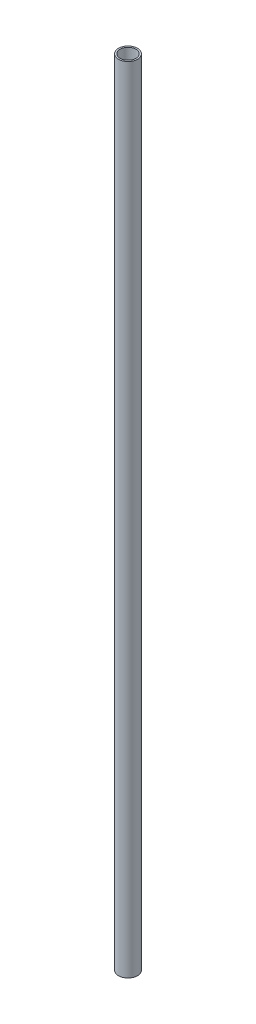
from build123d import *

# Parameters (mm, degrees)
BOSS_EXTRUDE1_DEPTH      = 250
BOSS_EXTRUDE1_DEPTH_BACK = 250
SKETCH1_R                = 6
SKETCH1_R_2              = 5


with BuildPart() as part:
    # Sketch1 → Boss-Extrude1 (new, two sides: drawn at the far end of the back side and taken through both)
    with BuildSketch(Plane(origin=(0, 0, 0), x_dir=(1, 0, 0), z_dir=(0, 1, 0)).offset(-BOSS_EXTRUDE1_DEPTH_BACK)):
        Circle(SKETCH1_R)
        Circle(SKETCH1_R_2, mode=Mode.SUBTRACT)
    extrude(amount=BOSS_EXTRUDE1_DEPTH + BOSS_EXTRUDE1_DEPTH_BACK)


solid = part.part
